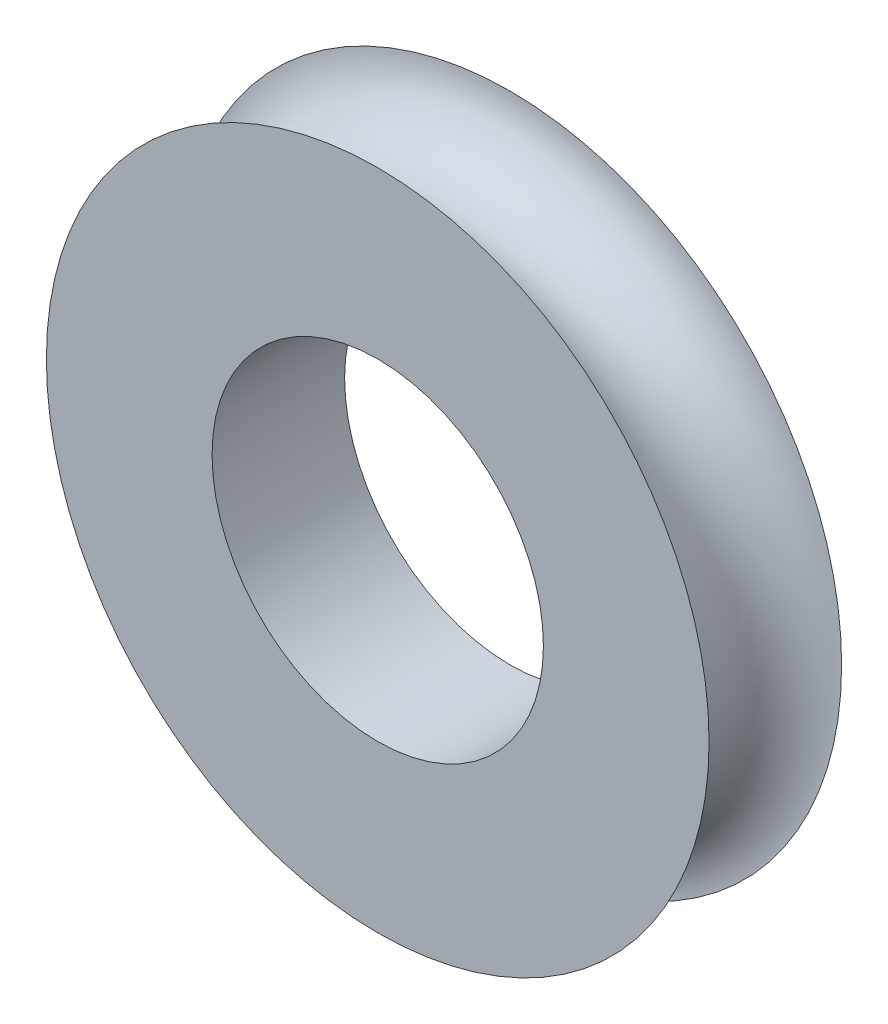
from build123d import *

# Parameters (mm, degrees)
SKETCH1_R           = 5
SKETCH1_R_2         = 2.5
BOSS_EXTRUDE1_DEPTH = 2


with BuildPart() as part:
    # Sketch1 → Boss-Extrude1 (new body)
    with BuildSketch(Plane.XY):
        Circle(SKETCH1_R)
        Circle(SKETCH1_R_2, mode=Mode.SUBTRACT)
    extrude(amount=BOSS_EXTRUDE1_DEPTH)

    # Sketch2 → Cut-Revolve1 (revolve, cut)
    with BuildSketch(Plane(origin=(0, 0, 0), x_dir=(0, 0, -1), z_dir=(1, 0, 0)), mode=Mode.PRIVATE) as cut_revolve1_sk:
        with BuildLine():
            Line((-2, 5), (0, 5))
            ThreePointArc((0, 5), (-1, 4), (-2, 5))
        make_face()
    revolve(cut_revolve1_sk.sketch.rotate(Axis((0, 0, 2), (0, 0, -1)), 90), axis=Axis((0, 0, 2), (0, 0, -1)), mode=Mode.SUBTRACT)


solid = part.part
